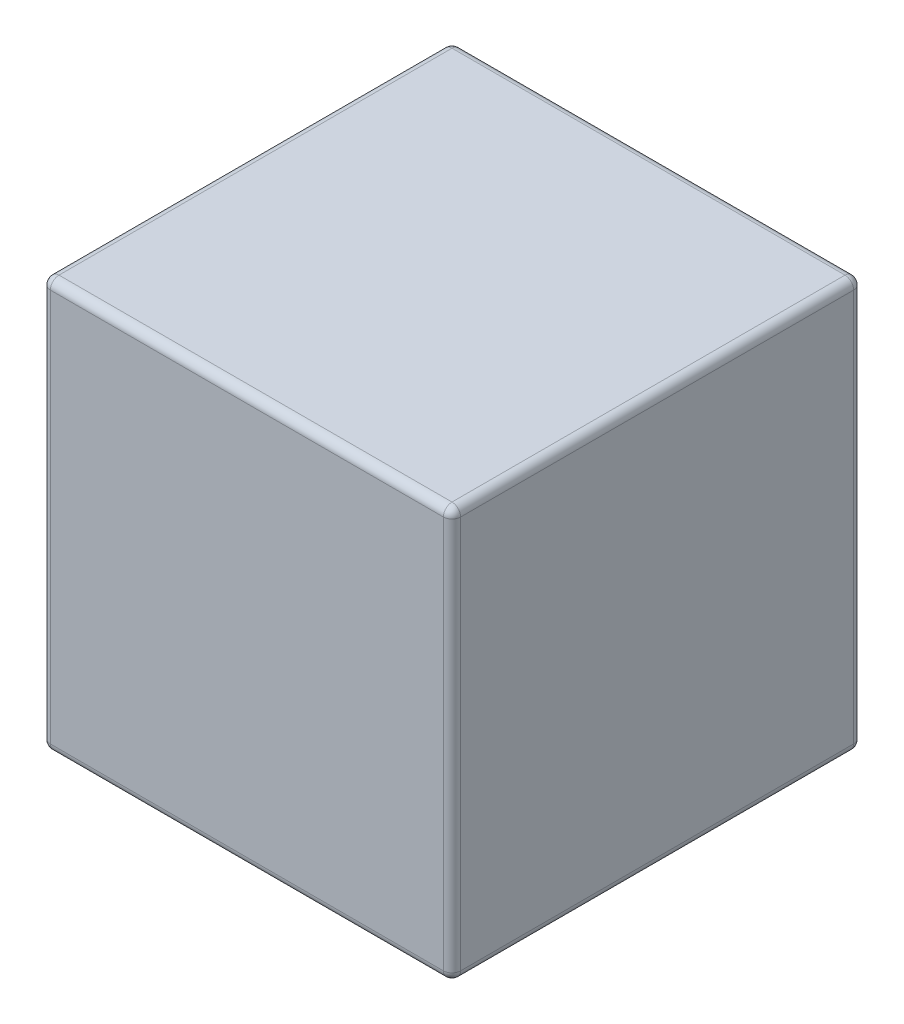
from build123d import *

# Parameters (mm, degrees)
SKETCH2_W           = 95
SKETCH2_H           = 95
BOSS_EXTRUDE1_DEPTH = 95
FILLET1_R           = 2


with BuildPart() as part:
    # Sketch2 → Boss-Extrude1 (new body)
    with BuildSketch(Plane(origin=(0, 0, 0), x_dir=(1, 0, 0), z_dir=(0, 1, 0))):
        Rectangle(SKETCH2_W, SKETCH2_H)
    extrude(amount=BOSS_EXTRUDE1_DEPTH)

    # Fillet1
    fillet1_edges = [part.edges().sort_by_distance(p)[0] for p in [
        (-47.5, 95, 0),
        (0, 95, 47.5),
        (47.5, 95, 0),
        (0, 0, 47.5),
        (-47.5, 0, 0),
        (0, 0, -47.5),
        (47.5, 0, 0),
        (0, 95, -47.5),
        (47.5, 47.5, 47.5),
        (-47.5, 47.5, 47.5),
        (-47.5, 47.5, -47.5),
        (47.5, 47.5, -47.5),
    ]]
    fillet(fillet1_edges, radius=FILLET1_R)


solid = part.part
